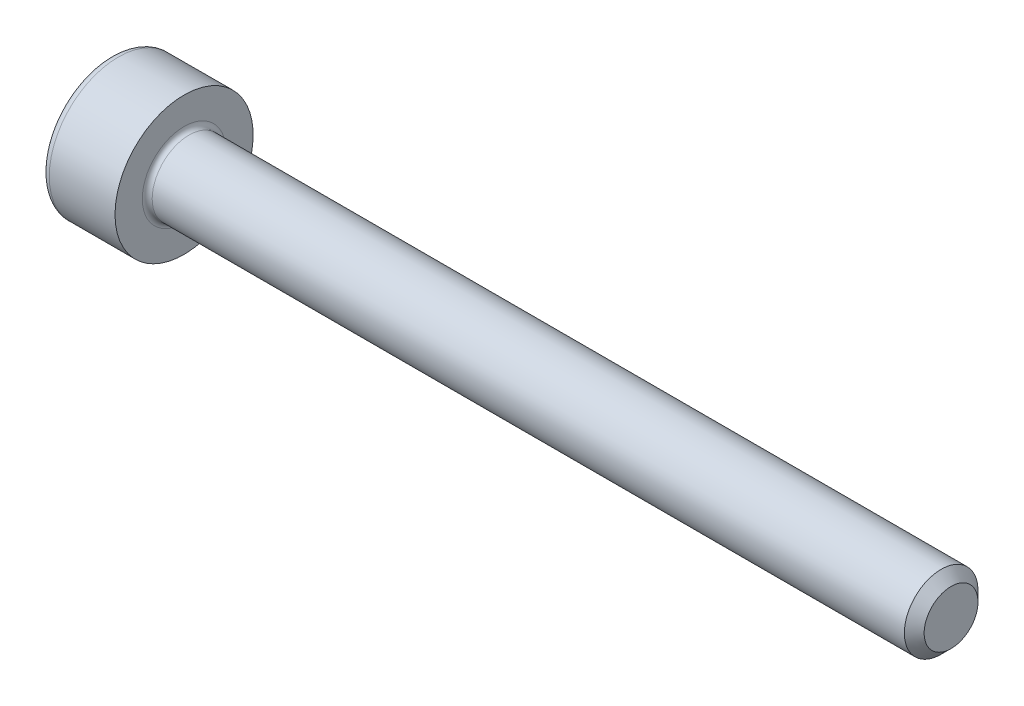
from build123d import *

# Parameters (mm, degrees)
FILLET1_R      = 0.1
FILLET2_R      = 0.16
CHAMFER1_SIZE  = 0.2
EXTRUDE1_DEPTH = 0.7


with BuildPart() as part:
    # Sketch1 → Revolve1 (revolve)
    with BuildSketch(Plane.XY, mode=Mode.PRIVATE) as revolve1_sk:
        Polygon((0, 1.395688245), (0, 0), (16.988734128, 0), (16.988734128, 0.744367064), (1.488734128, 0.744367064), (1.488734128, 1.395688245), align=None)
    revolve(revolve1_sk.sketch.rotate(Axis((0, 0, 0), (1, 0, 0)), 90), axis=Axis((0, 0, 0), (1, 0, 0)))

    # Fillet1
    fillet1_edges = [part.edges().sort_by_distance(p)[0] for p in [
        (1.488734128, 0, -0.744367064),
    ]]
    fillet(fillet1_edges, radius=FILLET1_R)

    # Fillet2
    fillet2_edges = [part.edges().sort_by_distance(p)[0] for p in [
        (0, 0, -1.395688245),
    ]]
    fillet(fillet2_edges, radius=FILLET2_R)

    # Chamfer1
    chamfer1_edges = [part.edges().sort_by_distance(p)[0] for p in [
        (16.988734128, 0, -0.744367064),
    ]]
    chamfer(chamfer1_edges, length=CHAMFER1_SIZE)

    # Sketch2 → Extrude1 (cut)
    with BuildSketch(Plane.ZY):
        Polygon((0, 0.877572409), (-0.76, 0.438786205), (-0.76, -0.438786205), (0, -0.877572409), (0.76, -0.438786205), (0.76, 0.438786205), align=None)
    extrude(amount=-EXTRUDE1_DEPTH, mode=Mode.SUBTRACT)


solid = part.part
